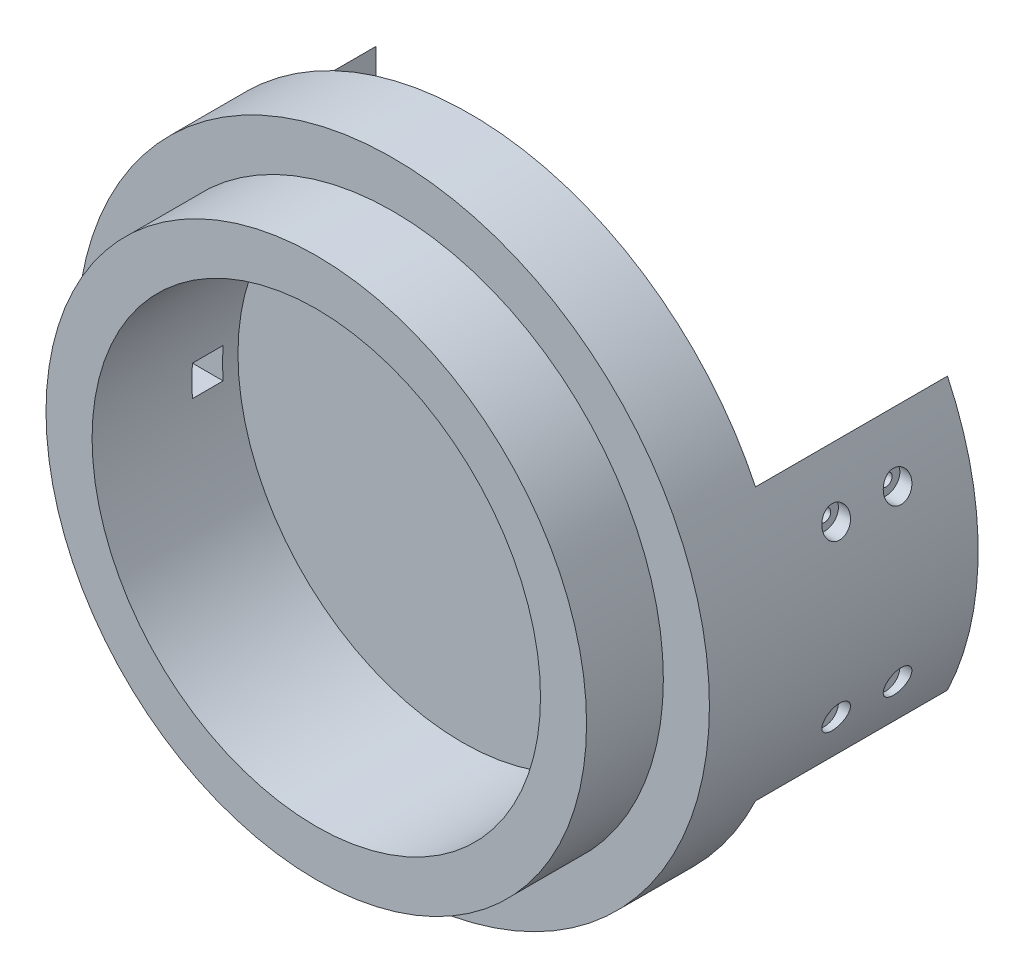
from build123d import *
from build123d.topology import SkipClean

# Parameters (mm, degrees)
SKETCH_1_R           = 41.2
EXTRUDE_1_DEPTH      = 20
SKETCH_2_R           = 29.2
CUT_EXTRUDE_1_DEPTH  = 10
SKETCH_3_OUTSIDE_W   = 108.048
SKETCH_3_OUTSIDE_H   = 108.048
SKETCH_3_OUTSIDE_R   = 35.2
CUT_EXTRUDE_2_DEPTH  = 10
SKETCH_4_R           = 29.2
CUT_EXTRUDE_3_DEPTH  = 9
SKETCH_5_W           = 3
SKETCH_5_H           = 4
CUT_EXTRUDE_4_DEPTH  = 7
SKETCH_6_W           = 4
SKETCH_6_H           = 4
CUT_EXTRUDE_5_DEPTH  = 7
SKETCH_7_W           = 4
SKETCH_7_H           = 82.4
EXTRUDE_2_DEPTH      = 25
SKETCH_8_OUTSIDE_W   = 109.384
SKETCH_8_OUTSIDE_H   = 109.384
SKETCH_8_OUTSIDE_R   = 41.2
CUT_EXTRUDE_6_DEPTH  = 25
SKETCH_9_W           = 3
SKETCH_9_H           = 4
CUT_EXTRUDE_7_DEPTH  = 25
SKETCH_10_R          = 2
CUT_EXTRUDE_8_DEPTH  = 9
SKETCH_11_R          = 0.8
CUT_EXTRUDE_9_DEPTH  = 1
SKETCH_12_R          = 1.8
CUT_EXTRUDE_13_DEPTH = 3
CUT_EXTRUDE_START    = -1
SKETCH_13_R          = 0.8
CUT_EXTRUDE_14_DEPTH = 1
CUT_EXTRUDE_START_2  = -3
SKETCH_14_R          = 1.8
CUT_EXTRUDE_15_DEPTH = 3


with BuildPart() as part:
    # 草图1 → 凸台-拉伸1 (new body)
    with BuildSketch(Plane.XY):
        Circle(SKETCH_1_R)
    extrude(amount=EXTRUDE_1_DEPTH)

    # 草图2 → 切除-拉伸1 (cut)
    with BuildSketch(Plane.XY.offset(20)):
        Circle(SKETCH_2_R)
    extrude(amount=-CUT_EXTRUDE_1_DEPTH, mode=Mode.SUBTRACT)

    # 草图3 outside → 切除-拉伸2 (cut)
    with BuildSketch(Plane.XY.offset(20)):
        Rectangle(SKETCH_3_OUTSIDE_W, SKETCH_3_OUTSIDE_H)
        Circle(SKETCH_3_OUTSIDE_R, mode=Mode.SUBTRACT)
    extrude(amount=-CUT_EXTRUDE_2_DEPTH, mode=Mode.SUBTRACT)

    # 草图4 → 切除-拉伸3 (cut)
    with BuildSketch(Plane.XY.offset(10)):
        Circle(SKETCH_4_R)
    extrude(amount=-CUT_EXTRUDE_3_DEPTH, mode=Mode.SUBTRACT)

    # 草图5 → 切除-拉伸4 (cut)
    with BuildSketch(Plane(origin=(0, 0, 0), x_dir=(-1, 0, 0), z_dir=(0, 0, -1))):
        with Locations((36.7, 0)):
            Rectangle(SKETCH_5_W, SKETCH_5_H)
    extrude(amount=-CUT_EXTRUDE_4_DEPTH, mode=Mode.SUBTRACT)

    # 草图6 → 切除-拉伸5 (cut)
    with BuildSketch(Plane.ZY.offset(35.2)):
        with Locations((5, 0)):
            Rectangle(SKETCH_6_W, SKETCH_6_H)
    extrude(amount=-CUT_EXTRUDE_5_DEPTH, mode=Mode.SUBTRACT)

    # 草图7 → 凸台-拉伸2 (add)
    with BuildSketch(Plane(origin=(0, 0, 0), x_dir=(-1, 0, 0), z_dir=(0, 0, -1))):
        with Locations((39.2, 0)):
            Rectangle(SKETCH_7_W, SKETCH_7_H)
        with Locations((-39.2, 0)):
            Rectangle(SKETCH_7_W, SKETCH_7_H)
    extrude(amount=EXTRUDE_2_DEPTH)

    # 草图8 outside → 切除-拉伸6 (cut)
    with SkipClean():  # the faces are left unmerged after this step: merging them gives an invalid solid
        with BuildSketch(Plane(origin=(0, 0, 0), x_dir=(-1, 0, 0), z_dir=(0, 0, -1))):
            Rectangle(SKETCH_8_OUTSIDE_W, SKETCH_8_OUTSIDE_H)
            with Locations(Location((0, 0, 0), (0, 0, 334.543599349))):
                Circle(SKETCH_8_OUTSIDE_R, mode=Mode.SUBTRACT)
        extrude(amount=CUT_EXTRUDE_6_DEPTH, mode=Mode.SUBTRACT)

    # 草图9 → 切除-拉伸7 (cut)
    with SkipClean():  # the faces are left unmerged after this step: merging them gives an invalid solid
        with BuildSketch(Plane(origin=(0, 0, 0), x_dir=(-1, 0, 0), z_dir=(0, 0, -1))):
            with Locations((36.7, 0)):
                Rectangle(SKETCH_9_W, SKETCH_9_H)
        extrude(amount=CUT_EXTRUDE_7_DEPTH, mode=Mode.SUBTRACT)

    # 草图10 → 切除-拉伸8 (cut)
    with SkipClean():  # the faces are left unmerged after this step: merging them gives an invalid solid
        with BuildSketch(Plane(origin=(0, 0, 0), x_dir=(-1, 0, 0), z_dir=(0, 0, -1))):
            with Locations((34.7, 11)):
                Circle(SKETCH_10_R)
            with Locations((34.7, -11)):
                Circle(SKETCH_10_R)
            with Locations((-34.7, 11)):
                Circle(SKETCH_10_R)
            with Locations((-34.7, -11)):
                Circle(SKETCH_10_R)
        extrude(amount=-CUT_EXTRUDE_8_DEPTH, mode=Mode.SUBTRACT)

    # 草图11 → 切除-拉伸9 (cut)
    with SkipClean():  # the faces are left unmerged after this step: merging them gives an invalid solid
        with BuildSketch(Plane.ZY.offset(-37.2)):
            with Locations((-16, -11)):
                Circle(SKETCH_11_R)
            with Locations((-8, -11)):
                Circle(SKETCH_11_R)
            with Locations((-16, 11)):
                Circle(SKETCH_11_R)
            with Locations((-8, 11)):
                Circle(SKETCH_11_R)
        extrude(amount=-CUT_EXTRUDE_9_DEPTH, mode=Mode.SUBTRACT)

    # 草图12 → 切除-拉伸13 (cut)
    with SkipClean():  # the faces are left unmerged after this step: merging them gives an invalid solid
        with BuildSketch(Plane.ZY.offset(-38.2)):
            with Locations((-16, -11)):
                Circle(SKETCH_12_R)
            with Locations((-8, -11)):
                Circle(SKETCH_12_R)
            with Locations((-16, 11)):
                Circle(SKETCH_12_R)
            with Locations((-8, 11)):
                Circle(SKETCH_12_R)
        extrude(amount=-CUT_EXTRUDE_13_DEPTH, mode=Mode.SUBTRACT)

    # 草图13 → 切除-拉伸14 (cut)
    with SkipClean():  # the faces are left unmerged after this step: merging them gives an invalid solid
        with BuildSketch(Plane(origin=(-37.2, 0, 0), x_dir=(0, 0, -1), z_dir=(1, 0, 0)).offset(CUT_EXTRUDE_START)):
            with Locations(Location((8, 11, 0), (0, 0, 180))):
                Circle(SKETCH_13_R)
            with Locations(Location((16, 11, 0), (0, 0, 180))):
                Circle(SKETCH_13_R)
            with Locations(Location((8, -11, 0), (0, 0, 180))):
                Circle(SKETCH_13_R)
            with Locations(Location((16, -11, 0), (0, 0, 180))):
                Circle(SKETCH_13_R)
        extrude(amount=CUT_EXTRUDE_14_DEPTH, mode=Mode.SUBTRACT)

    # 草图14 → 切除-拉伸15 (cut)
    with SkipClean():  # the faces are left unmerged after this step: merging them gives an invalid solid
        with BuildSketch(Plane(origin=(-38.2, 0, 0), x_dir=(0, 0, -1), z_dir=(1, 0, 0)).offset(CUT_EXTRUDE_START_2)):
            with Locations(Location((8, 11, 0), (0, 0, 180))):
                Circle(SKETCH_14_R)
            with Locations(Location((16, 11, 0), (0, 0, 180))):
                Circle(SKETCH_14_R)
            with Locations(Location((8, -11, 0), (0, 0, 180))):
                Circle(SKETCH_14_R)
            with Locations(Location((16, -11, 0), (0, 0, 180))):
                Circle(SKETCH_14_R)
        extrude(amount=CUT_EXTRUDE_15_DEPTH, mode=Mode.SUBTRACT)


solid = part.part
